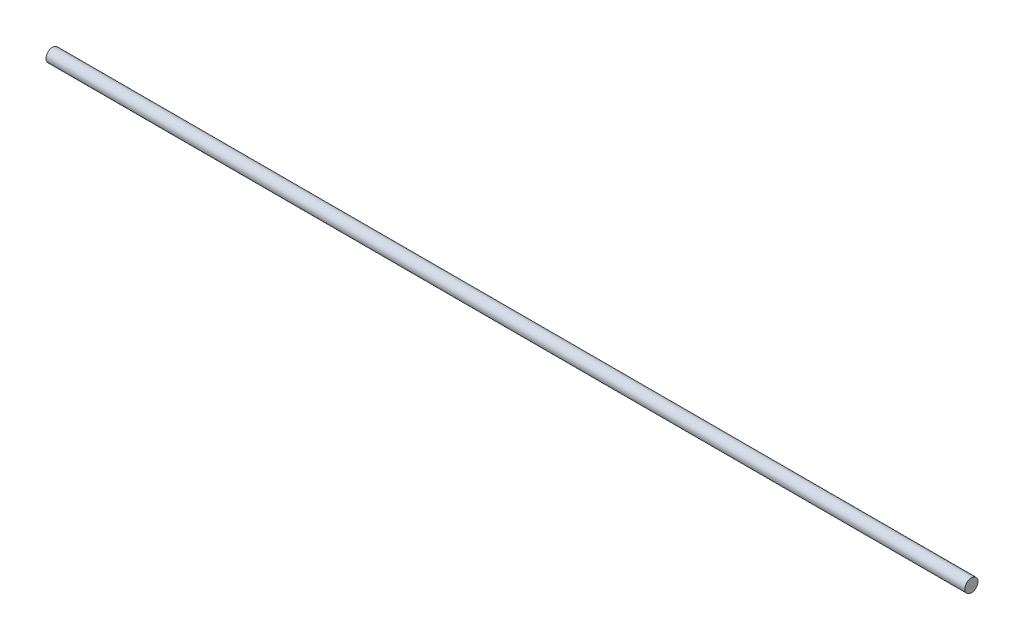
from build123d import *

# Parameters (mm, degrees)
SKETCH2_R           = 2.5
BOSS_EXTRUDE1_DEPTH = 350


with BuildPart() as part:
    # Sketch2 → Boss-Extrude1 (new body)
    with BuildSketch(Plane(origin=(0, 0, 0), x_dir=(0, 0, -1), z_dir=(1, 0, 0))):
        Circle(SKETCH2_R)
    extrude(amount=-BOSS_EXTRUDE1_DEPTH)


solid = part.part
